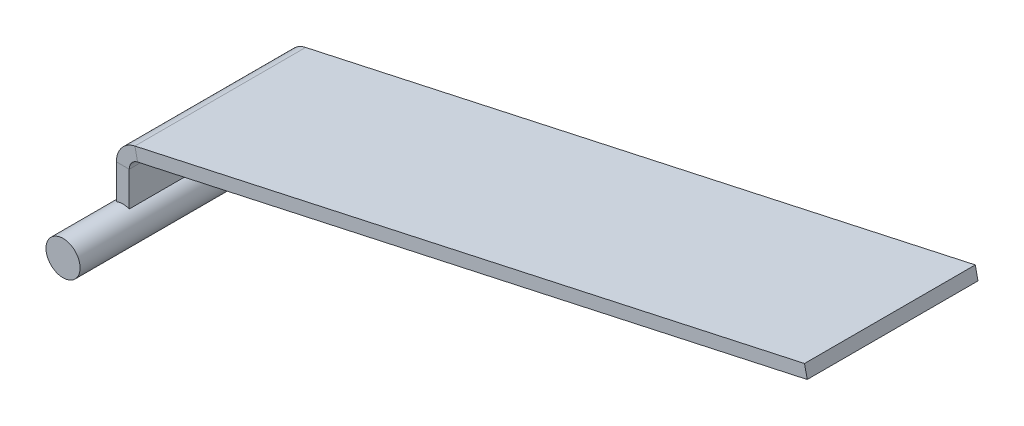
from build123d import *

# Parameters (mm, degrees)
SKETCH2_W           = 0.3
SKETCH2_H           = 4
SKETCH4_R           = 0.4
BOSS_EXTRUDE1_DEPTH = 3.4


with BuildPart() as part:
    # Sweep1: sweep along a path in Sketch1
    with BuildLine(Plane.XY) as sweep1_path:
        Line((0, 0), (0, 1.178041516))
        ThreePointArc((0, 1.178041516), (0.08839809, 1.428848712), (0.314521248, 1.568801523))
        Line((0.314521248, 1.568801523), (16, 5))
    # Sketch2 → Sweep1 (sweep)
    with BuildSketch(Plane(origin=(0, 0, 0), x_dir=(1, 0, 0), z_dir=(0, 1, 0))):
        Rectangle(SKETCH2_W, SKETCH2_H)
    sweep(path=sweep1_path.line)

    # Sketch4 → Boss-Extrude1 (add, symmetric)
    with BuildSketch(Plane.XY):
        Circle(SKETCH4_R)
    extrude(amount=BOSS_EXTRUDE1_DEPTH, both=True)


solid = part.part
